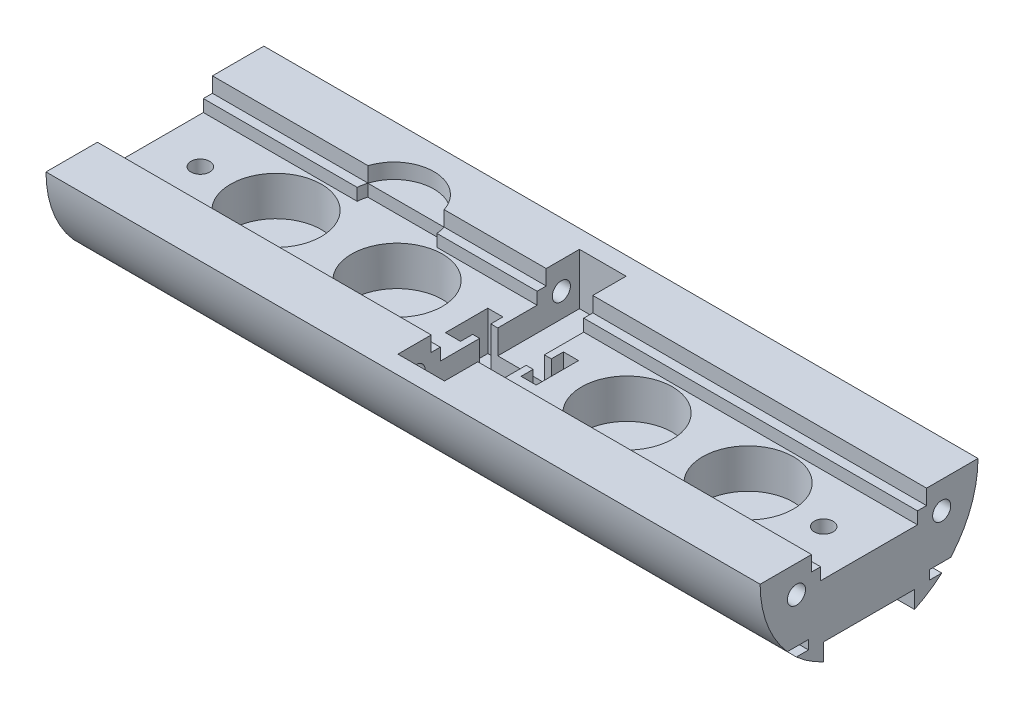
from build123d import *

# Parameters (mm, degrees)
SLED_DEPTH                       = 299.72
SKETCH12_R                       = 19.05
SPRING_INSERTS_DEPTH             = 27.94
SKETCH4_R                        = 3.81
THREADED_ROD_SLOTS_DEPTH         = 304.8
SKETCH13_W                       = 19.558
SKETCH13_H                       = 76.2
SPRING_PLATE_SLOT_DEPTH          = 21.59
MOD_TO_FIT_IN_COUPLER_DEPTH      = 320.04
MOD_TO_FIT_IN_COUPLER_DEPTH_BACK = 77.47
SKETCH17_R                       = 3.937
CAN_CORD_HOLES_DEPTH             = 62.992
INSERTION_GUIDE_RAILS_DEPTH      = 314.452
LOCKING_PIN_DEPTH                = 27.94
SKETCH20_R                       = 16.764
CUT_EXTRUDE1_DEPTH               = 6.35
CUT_EXTRUDE2_DEPTH               = 11.43


with BuildPart() as part:
    # Sketch3 → Sled (new body)
    with BuildSketch(Plane(origin=(0, 0, 0), x_dir=(0, 0, -1), z_dir=(1, 0, 0))):
        with BuildLine():
            Line((-49.53, 0), (-24.13, 0))
            Line((-24.13, 0), (-24.13, -6.35))
            Line((-24.13, -6.35), (-20.32, -6.35))
            Line((-20.32, -6.35), (-20.32, -11.43))
            Line((-20.32, -11.43), (20.32, -11.43))
            Line((20.32, -11.43), (20.32, -6.35))
            Line((20.32, -6.35), (24.13, -6.35))
            Line((24.13, -6.35), (24.13, 0))
            Line((24.13, 0), (49.53, 0))
            ThreePointArc((49.53, 0), (41.211451079, -27.474300719), (19.05, -45.72))
            Line((19.05, -45.72), (19.05, -34.29))
            Line((19.05, -34.29), (-19.05, -34.29))
            Line((-19.05, -34.29), (-19.05, -45.72))
            ThreePointArc((-19.05, -45.72), (-41.211451079, -27.474300719), (-49.53, 0))
        make_face()
    extrude(amount=SLED_DEPTH)

    # Sketch12 → Spring Inserts (cut)
    with BuildSketch(Plane(origin=(0, 0, 0), x_dir=(1, 0, 0), z_dir=(0, 1, 0))):
        with Locations(Location((50.8, 0, 0), (0, 0, 270))):
            Circle(SKETCH12_R)
        with Locations(Location((248.92, 0, 0), (0, 0, 90))):
            Circle(SKETCH12_R)
        with Locations(Location((101.6, 0, 0), (0, 0, 270))):
            Circle(SKETCH12_R)
        with Locations(Location((198.12, 0, 0), (0, 0, 90))):
            Circle(SKETCH12_R)
    extrude(amount=-SPRING_INSERTS_DEPTH, mode=Mode.SUBTRACT)

    # Sketch4 → Threaded Rod Slots (cut)
    with BuildSketch(Plane(origin=(0, 0, 0), x_dir=(0, 0, -1), z_dir=(1, 0, 0))):
        with Locations(Location((-30.48, -11.43, 0), (0, 0, 180))):
            Circle(SKETCH4_R)
        with Locations(Location((30.48, -11.43, 0), (0, 0, 180))):
            Circle(SKETCH4_R)
    extrude(amount=THREADED_ROD_SLOTS_DEPTH, mode=Mode.SUBTRACT)

    # Sketch13 → Spring Plate Slot (cut)
    with BuildSketch(Plane(origin=(0, 0, 0), x_dir=(1, 0, 0), z_dir=(0, 1, 0))):
        with Locations((149.86, 0)):
            Rectangle(SKETCH13_W, SKETCH13_H)
    extrude(amount=-SPRING_PLATE_SLOT_DEPTH, mode=Mode.SUBTRACT)

    # Sketch16 → Mod to fit in coupler (cut, two sides: drawn at the far end of the back side and taken through both)
    with BuildSketch(Plane(origin=(0, 0, 0), x_dir=(0, 0, -1), z_dir=(1, 0, 0)).offset(-MOD_TO_FIT_IN_COUPLER_DEPTH_BACK)):
        with BuildLine():
            Line((-45.397424247, 5.421463987), (-55.982128016, 1.685686186))
            Line((-55.982128016, 1.685686186), (-46.435140302, -53.451626912))
            Line((-46.435140302, -53.451626912), (-2.643522748, -59.401198965))
            Line((-2.643522748, -59.401198965), (46.059950804, -46.118433451))
            Line((46.059950804, -46.118433451), (57.336465277, 3.138488664))
            Line((57.336465277, 3.138488664), (45.312886192, 6.087753686))
            ThreePointArc((45.312886192, 6.087753686), (0.335815666, -45.718766692), (-45.397424247, 5.421463987))
        make_face()
    extrude(amount=MOD_TO_FIT_IN_COUPLER_DEPTH + MOD_TO_FIT_IN_COUPLER_DEPTH_BACK, mode=Mode.SUBTRACT)

    # Sketch17 → Can Cord Holes (cut)
    with BuildSketch(Plane(origin=(0, 0, 0), x_dir=(1, 0, 0), z_dir=(0, 1, 0))):
        with Locations(Location((280.67, 0, 0), (0, 0, 270))):
            Circle(SKETCH17_R)
        with Locations(Location((19.05, 0, 0), (0, 0, 270))):
            Circle(SKETCH17_R)
    extrude(amount=-CAN_CORD_HOLES_DEPTH, mode=Mode.SUBTRACT)

    # Sketch18 → Insertion Guide Rails (cut)
    with BuildSketch(Plane(origin=(0, 0, 0), x_dir=(0, 0, -1), z_dir=(1, 0, 0))):
        Polygon((-34.29, -30.240937485), (-25.4, -30.240937485), (-25.4, -34.050937485), (-30.50986818, -34.050937485), (-38.766826884, -32.646576067), align=None)
        Polygon((25.4, -34.050937485), (30.50986818, -34.050937485), (38.766826884, -32.646576067), (34.29, -30.240937485), (25.4, -30.240937485), align=None)
    extrude(amount=INSERTION_GUIDE_RAILS_DEPTH, mode=Mode.SUBTRACT)

    # Sketch19 → Locking Pin (cut)
    with BuildSketch(Plane(origin=(0, 0, 0), x_dir=(1, 0, 0), z_dir=(0, 1, 0))):
        Polygon((162.56, 3.81), (137.16, 3.81), (137.16, 8.89), (130.81, 8.89), (130.81, -8.89), (137.16, -8.89), (137.16, -3.81), (162.56, -3.81), (162.56, -8.89), (168.91, -8.89), (168.91, 8.89), (162.56, 8.89), align=None)
    extrude(amount=-LOCKING_PIN_DEPTH, mode=Mode.SUBTRACT)

    # Sketch20 → Cut-Extrude1 (cut)
    with BuildSketch(Plane(origin=(0, 0, 0), x_dir=(1, 0, 0), z_dir=(0, 1, 0))):
        with Locations((81.28, 19.05)):
            Circle(SKETCH20_R)
    extrude(amount=-CUT_EXTRUDE1_DEPTH, mode=Mode.SUBTRACT)

    # Sketch21 → Cut-Extrude2 (cut)
    with BuildSketch(Plane(origin=(0, 0, 0), x_dir=(1, 0, 0), z_dir=(0, 1, 0))):
        with BuildLine():
            Line((97.266479016, 24.096204976), (65.284485664, 24.067491117))
            ThreePointArc((65.284485664, 24.067491117), (81.295050936, 2.286006756), (97.266479016, 24.096204976))
        make_face()
    extrude(amount=-CUT_EXTRUDE2_DEPTH, mode=Mode.SUBTRACT)


solid = part.part
